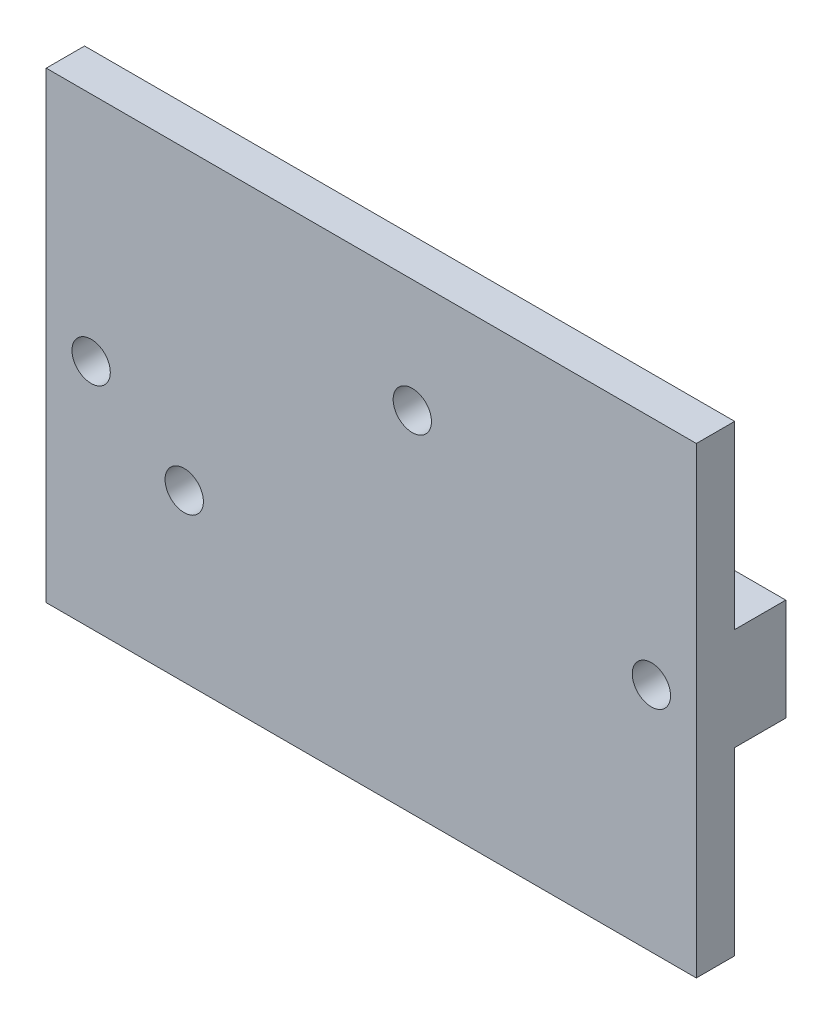
from build123d import *

# Parameters (mm, degrees)
SKETCH_1_W      = 50.88
SKETCH_1_H      = 36.23
SKETCH_1_R      = 1.5
EXTRUDE_1_DEPTH = 3
SKETCH_2_W      = 6.361490509
SKETCH_2_H      = 8
SKETCH_2_R      = 2.5
SKETCH_2_W_2    = 6.95769393
EXTRUDE_2_DEPTH = 4


with BuildPart() as part:
    # 草图1 → 凸台-拉伸1 (new body)
    with BuildSketch(Plane.XY):
        with Locations((21.925, 0)):
            Rectangle(SKETCH_1_W, SKETCH_1_H)
        Circle(SKETCH_1_R, mode=Mode.SUBTRACT)
        with Locations((43.85, 0)):
            Circle(SKETCH_1_R, mode=Mode.SUBTRACT)
        with Locations((7.285, -5.115)):
            Circle(SKETCH_1_R, mode=Mode.SUBTRACT)
        with Locations((25.135, 9.235)):
            Circle(SKETCH_1_R, mode=Mode.SUBTRACT)
    extrude(amount=EXTRUDE_1_DEPTH)

    # 草图2 → 凸台-拉伸2 (add)
    # profile 1 of 2: a face of its own
    with BuildSketch(Plane(origin=(0, 0, 0), x_dir=(-1, 0, 0), z_dir=(0, 0, -1))):
        with Locations((0.334254746, 0)):
            Rectangle(SKETCH_2_W, SKETCH_2_H)
        Circle(SKETCH_2_R, mode=Mode.SUBTRACT)
    # profile 2 of 2: a face of its own
    with BuildSketch(Plane(origin=(0, 0, 0), x_dir=(-1, 0, 0), z_dir=(0, 0, -1))):
        with Locations((-43.886153035, 0)):
            Rectangle(SKETCH_2_W_2, SKETCH_2_H)
        with Locations((-43.85, 0)):
            Circle(SKETCH_2_R, mode=Mode.SUBTRACT)
    extrude(amount=EXTRUDE_2_DEPTH)


solid = part.part
